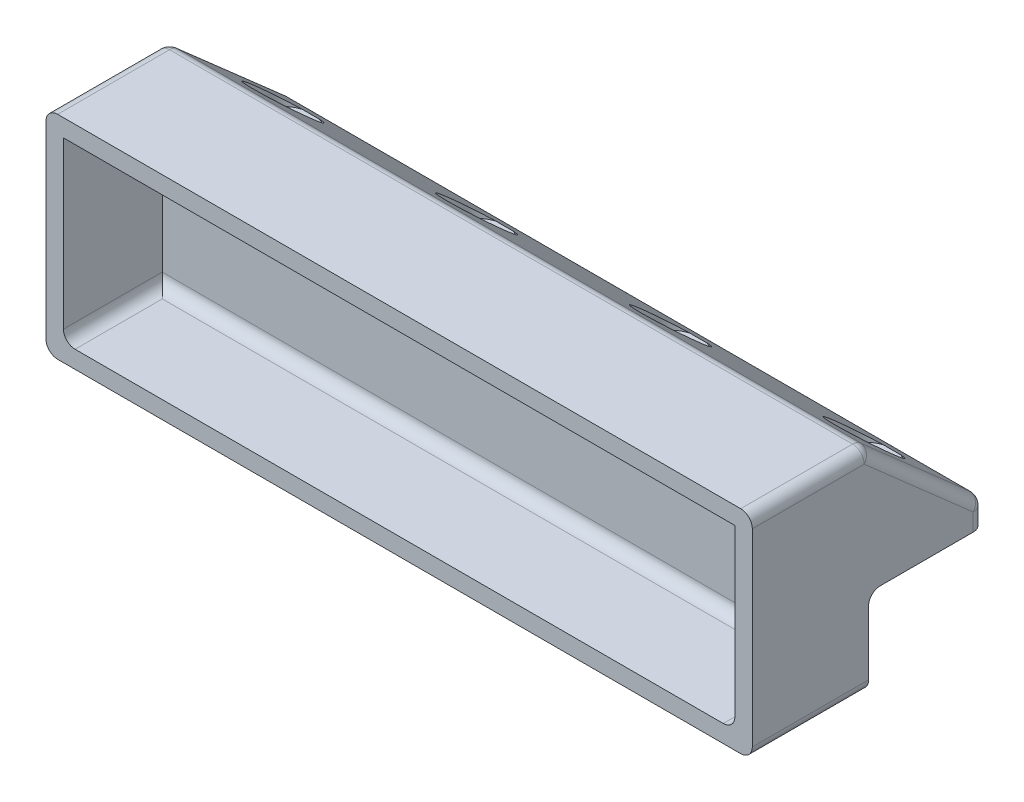
from build123d import *

# Parameters (mm, degrees)
SKETCH1_W                      = 121.5
SKETCH1_H                      = 36.5
SKETCH1_W_2                    = 115.5
SKETCH1_H_2                    = 30.5
BOSS_EXTRUDE1_DEPTH            = 3
SKETCH1_3_W                    = 121.5
SKETCH1_3_H                    = 36.5
SKETCH1_3_W_2                  = 115.5
SKETCH1_3_H_2                  = 30.5
BOSS_EXTRUDE2_DEPTH            = 17
BOSS_EXTRUDE3_DEPTH            = 118.5
BOSS_EXTRUDE3_DEPTH_BACK       = 3
CBORE_FOR_M5_SHCS1_D           = 5.3
CBORE_FOR_M5_SHCS1_CBORE_D     = 10
CBORE_FOR_M5_SHCS1_CBORE_DEPTH = 13
FILLET1_R                      = 2


with BuildPart() as part:
    # Sketch1 → Boss-Extrude1 (new body)
    # profile 1 of 2: a face of its own
    with BuildSketch(Plane.XY):
        with Locations((57.75, 15.25)):
            Rectangle(SKETCH1_W, SKETCH1_H)
        with Locations((57.75, 15.25)):
            Rectangle(SKETCH1_W_2, SKETCH1_H_2, mode=Mode.SUBTRACT)
    # profile 2 of 2: a face of its own
    with BuildSketch(Plane.XY):
        with Locations((57.75, 15.25)):
            Rectangle(SKETCH1_W_2, SKETCH1_H_2)
    extrude(amount=-BOSS_EXTRUDE1_DEPTH)

    # Sketch1<3> → Boss-Extrude2 (add)
    with BuildSketch(Plane.XY):
        with Locations((57.75, 15.25)):
            Rectangle(SKETCH1_3_W, SKETCH1_3_H)
        with Locations((57.75, 15.25)):
            Rectangle(SKETCH1_3_W_2, SKETCH1_3_H_2, mode=Mode.SUBTRACT)
    extrude(amount=BOSS_EXTRUDE2_DEPTH)

    # Sketch2 → Boss-Extrude3 (add, two sides: drawn at the far end of the back side and taken through both)
    with BuildSketch(Plane(origin=(0, 0, 0), x_dir=(0, 0, -1), z_dir=(1, 0, 0)).offset(-BOSS_EXTRUDE3_DEPTH_BACK)):
        with BuildLine():
            Line((3, 33.5), (3, 12))
            Line((3, 12), (23, 12))
            Line((23, 12), (23, 15))
            ThreePointArc((23, 15), (22.822381628, 15.823969176), (22.321074797, 16.501586289))
            Line((22.321074797, 16.501586289), (3, 33.5))
        make_face()
    extrude(amount=BOSS_EXTRUDE3_DEPTH + BOSS_EXTRUDE3_DEPTH_BACK)

    # CBORE for M5 SHCS1 (through all)
    with Locations(Plane(origin=(0, 33.5, 0), x_dir=(1, 0, 0), z_dir=(0, 1, 0))):
        with Locations((7.75, 13), (41.083333333, 13), (74.416666667, 13), (107.75, 13)):
            CounterBoreHole(CBORE_FOR_M5_SHCS1_D / 2, CBORE_FOR_M5_SHCS1_CBORE_D / 2, CBORE_FOR_M5_SHCS1_CBORE_DEPTH)

    # Fillet1
    fillet1_edges = [part.edges().sort_by_distance(p)[0] for p in [
        (57.75, 33.5, -3),
        (57.75, 0, 0),
        (115.5, 0, 8.5),
        (0, 0, 8.5),
        (-3, 13.5, -23),
        (-3, 15.823969176, -22.822381628),
        (-3, 25.000793144, -12.660537398),
        (57.75, 12, -3),
        (118.5, 13.5, -23),
        (118.5, 15.823969176, -22.822381628),
        (118.5, 25.000793144, -12.660537398),
        (118.5, -3, 7),
        (-3, -3, 7),
        (-3, 33.5, 7),
        (118.5, 33.5, 7),
    ]]
    fillet(fillet1_edges, radius=FILLET1_R)


solid = part.part
